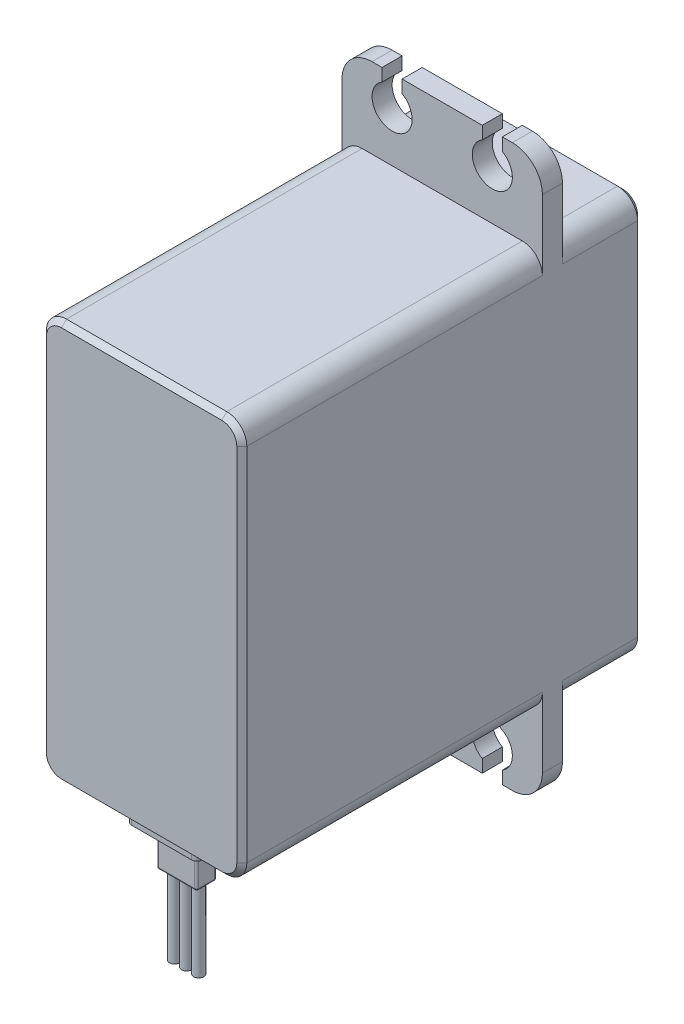
from build123d import *

# Parameters (mm, degrees)
SKETCH_1_W             = 20
SKETCH_1_H             = 56
EXTRUDE_1_DEPTH        = 40
SKETCH_2_OUTSIDE_W     = 36.334
SKETCH_2_OUTSIDE_H     = 72.334
SKETCH_2_OUTSIDE_W_2   = 20
SKETCH_2_OUTSIDE_H_2   = 40
CUT_EXTRUDE_1_DEPTH    = 30
CUT_EXTRUDE_START      = -40
SKETCH_2_2_OUTSIDE_W   = 36.334
SKETCH_2_2_OUTSIDE_H   = 72.334
SKETCH_2_2_OUTSIDE_W_2 = 20
SKETCH_2_2_OUTSIDE_H_2 = 40
CUT_EXTRUDE_2_DEPTH    = 8
CUT_EXTRUDE_3_DEPTH    = 43.237424164
SKETCH_4_W             = 7
SKETCH_4_H             = 5
EXTRUDE_2_DEPTH        = 2
SKETCH_5_W             = 4
SKETCH_5_H             = 2
EXTRUDE_3_DEPTH        = 4
SKETCH_6_R             = 0.5
EXTRUDE_4_DEPTH        = 8
SKETCH_7_R             = 6
EXTRUDE_5_DEPTH        = 2
SKETCH_8_R             = 5
CUT_EXTRUDE_4_DEPTH    = 0.8
SKETCH_9_R             = 2.5
CUT_EXTRUDE_5_DEPTH    = 4
SKETCH_10_R            = 2.5
EXTRUDE_6_DEPTH        = 10
CUT_EXTRUDE_6_DEPTH    = 60.02406289
FILLET_1_R             = 3
FILLET_2_R             = 2
FILLET_3_R             = 0.5
FILLET_4_R             = 0.2
CHAMFER_1_SIZE         = 0.5


with BuildPart() as part:
    # 草图1 → 凸台-拉伸1 (new body)
    with BuildSketch(Plane.XY):
        Rectangle(SKETCH_1_W, SKETCH_1_H)
    extrude(amount=EXTRUDE_1_DEPTH)

    # 草图2 outside → 切除-拉伸1 (cut)
    with BuildSketch(Plane.XY.offset(40)):
        Rectangle(SKETCH_2_OUTSIDE_W, SKETCH_2_OUTSIDE_H)
        Rectangle(SKETCH_2_OUTSIDE_W_2, SKETCH_2_OUTSIDE_H_2, mode=Mode.SUBTRACT)
    extrude(amount=-CUT_EXTRUDE_1_DEPTH, mode=Mode.SUBTRACT)

    # 草图2<2> outside → 切除-拉伸2 (cut)
    with BuildSketch(Plane.XY.offset(40).offset(CUT_EXTRUDE_START)):
        Rectangle(SKETCH_2_2_OUTSIDE_W, SKETCH_2_2_OUTSIDE_H)
        Rectangle(SKETCH_2_2_OUTSIDE_W_2, SKETCH_2_2_OUTSIDE_H_2, mode=Mode.SUBTRACT)
    extrude(amount=CUT_EXTRUDE_2_DEPTH, mode=Mode.SUBTRACT)

    # 草图3 → 切除-拉伸3 (cut, through all)
    with BuildSketch(Plane.XY.offset(10)):
        with BuildLine():
            Line((4, 26.732050808), (4, 28))
            Line((4, 28), (6, 28))
            Line((6, 28), (6, 26.732050808))
            ThreePointArc((6, 26.732050808), (5, 23), (4, 26.732050808))
        make_face()
        with BuildLine():
            Line((-6, 26.732050808), (-6, 28))
            Line((-6, 28), (-4, 28))
            Line((-4, 28), (-4, 26.732050808))
            ThreePointArc((-4, 26.732050808), (-5, 23), (-6, 26.732050808))
        make_face()
        with BuildLine():
            Line((-4, -28), (-4, -26.732050808))
            ThreePointArc((-4, -26.732050808), (-5, -23), (-6, -26.732050808))
            Line((-6, -26.732050808), (-6, -28))
            Line((-6, -28), (-4, -28))
        make_face()
        with BuildLine():
            Line((6, -28), (6, -26.732050808))
            ThreePointArc((6, -26.732050808), (5, -23), (4, -26.732050808))
            Line((4, -26.732050808), (4, -28))
            Line((4, -28), (6, -28))
        make_face()
    extrude(amount=-CUT_EXTRUDE_3_DEPTH, mode=Mode.SUBTRACT)

    # 草图4 → 凸台-拉伸2 (add)
    with BuildSketch(Plane.XZ.offset(20)):
        with Locations((0, 35.5)):
            Rectangle(SKETCH_4_W, SKETCH_4_H)
    extrude(amount=EXTRUDE_2_DEPTH)

    # 草图5 → 凸台-拉伸3 (add)
    with BuildSketch(Plane.XZ.offset(22)):
        with Locations((0, 35.5)):
            Rectangle(SKETCH_5_W, SKETCH_5_H)
    extrude(amount=EXTRUDE_3_DEPTH)

    # 草图6 → 凸台-拉伸4 (add)
    with BuildSketch(Plane.XZ.offset(26)):
        with Locations(Location((1.2, 35.5, 0), (0, 0, 90))):
            Circle(SKETCH_6_R)
        with Locations(Location((0, 35.5, 0), (0, 0, 90))):
            Circle(SKETCH_6_R)
        with Locations(Location((-1.2, 35.5, 0), (0, 0, 90))):
            Circle(SKETCH_6_R)
    extrude(amount=EXTRUDE_4_DEPTH)

    # 草图7 → 凸台-拉伸5 (add)
    with BuildSketch(Plane(origin=(0, 0, 0), x_dir=(-1, 0, 0), z_dir=(0, 0, -1))):
        with Locations((0, -12)):
            Circle(SKETCH_7_R)
    extrude(amount=EXTRUDE_5_DEPTH)

    # 草图8 → 切除-拉伸4 (cut)
    with BuildSketch(Plane(origin=(0, 0, -2), x_dir=(-1, 0, 0), z_dir=(0, 0, -1))):
        with Locations((0, -12)):
            Circle(SKETCH_8_R)
    extrude(amount=-CUT_EXTRUDE_4_DEPTH, mode=Mode.SUBTRACT)

    # 草图9 → 切除-拉伸5 (cut)
    with BuildSketch(Plane(origin=(0, 0, -1.2), x_dir=(-1, 0, 0), z_dir=(0, 0, -1))):
        with Locations((0, -12)):
            Circle(SKETCH_9_R)
    extrude(amount=-CUT_EXTRUDE_5_DEPTH, mode=Mode.SUBTRACT)


with BuildPart() as body_2:
    # 草图10 → 凸台-拉伸6 (new body)
    with BuildSketch(Plane(origin=(0, 0, 2.8), x_dir=(-1, 0, 0), z_dir=(0, 0, -1))):
        with Locations((0, -12)):
            Circle(SKETCH_10_R)
    extrude(amount=EXTRUDE_6_DEPTH)

    # 草图11 → 切除-拉伸6 (cut, through all)
    with BuildSketch(Plane(origin=(0, 0, -7.2), x_dir=(-1, 0, 0), z_dir=(0, 0, -1))):
        with BuildLine():
            Line((0, -10), (-0.27961852, -9.515686517))
            ThreePointArc((-0.27961852, -9.515686517), (0, -9.5), (0.27961852, -9.515686517))
            Line((0.27961852, -9.515686517), (0, -10))
        make_face()
        with BuildLine():
            Line((0.618033989, -10.097886967), (0.50176207, -9.550870599))
            ThreePointArc((0.50176207, -9.550870599), (0.772542486, -9.622358709), (1.033628101, -9.723684348))
            Line((1.033628101, -9.723684348), (0.618033989, -10.097886967))
        make_face()
        with BuildLine():
            Line((1.175570505, -10.381966011), (1.234026693, -9.82579253))
            ThreePointArc((1.234026693, -9.82579253), (1.469463131, -9.977457514), (1.686458962, -10.154503815))
            Line((1.686458962, -10.154503815), (1.175570505, -10.381966011))
        make_face()
        with BuildLine():
            Line((1.618033989, -10.824429495), (1.845496185, -10.313541038))
            ThreePointArc((1.845496185, -10.313541038), (2.022542486, -10.530536869), (2.17420747, -10.765973307))
            Line((2.17420747, -10.765973307), (1.618033989, -10.824429495))
        make_face()
        with BuildLine():
            Line((1.902113033, -11.381966011), (2.276315652, -10.966371899))
            ThreePointArc((2.276315652, -10.966371899), (2.377641291, -11.227457514), (2.449129401, -11.49823793))
            Line((2.449129401, -11.49823793), (1.902113033, -11.381966011))
        make_face()
        with BuildLine():
            Line((2, -12), (2.484313483, -11.72038148))
            ThreePointArc((2.484313483, -11.72038148), (2.5, -12), (2.484313483, -12.27961852))
            Line((2.484313483, -12.27961852), (2, -12))
        make_face()
        with BuildLine():
            Line((1.902113033, -12.618033989), (2.449129401, -12.50176207))
            ThreePointArc((2.449129401, -12.50176207), (2.377641291, -12.772542486), (2.276315652, -13.033628101))
            Line((2.276315652, -13.033628101), (1.902113033, -12.618033989))
        make_face()
        with BuildLine():
            Line((1.618033989, -13.175570505), (2.17420747, -13.234026693))
            ThreePointArc((2.17420747, -13.234026693), (2.022542486, -13.469463131), (1.845496185, -13.686458962))
            Line((1.845496185, -13.686458962), (1.618033989, -13.175570505))
        make_face()
        with BuildLine():
            Line((1.175570505, -13.618033989), (1.686458962, -13.845496185))
            ThreePointArc((1.686458962, -13.845496185), (1.469463131, -14.022542486), (1.234026693, -14.17420747))
            Line((1.234026693, -14.17420747), (1.175570505, -13.618033989))
        make_face()
        with BuildLine():
            Line((0.618033989, -13.902113033), (1.033628101, -14.276315652))
            ThreePointArc((1.033628101, -14.276315652), (0.772542486, -14.377641291), (0.50176207, -14.449129401))
            Line((0.50176207, -14.449129401), (0.618033989, -13.902113033))
        make_face()
        with BuildLine():
            Line((0, -14), (0.27961852, -14.484313483))
            ThreePointArc((0.27961852, -14.484313483), (0, -14.5), (-0.27961852, -14.484313483))
            Line((-0.27961852, -14.484313483), (0, -14))
        make_face()
        with BuildLine():
            Line((-0.618033989, -13.902113033), (-0.50176207, -14.449129401))
            ThreePointArc((-0.50176207, -14.449129401), (-0.772542486, -14.377641291), (-1.033628101, -14.276315652))
            Line((-1.033628101, -14.276315652), (-0.618033989, -13.902113033))
        make_face()
        with BuildLine():
            Line((-1.175570505, -13.618033989), (-1.234026693, -14.17420747))
            ThreePointArc((-1.234026693, -14.17420747), (-1.469463131, -14.022542486), (-1.686458962, -13.845496185))
            Line((-1.686458962, -13.845496185), (-1.175570505, -13.618033989))
        make_face()
        with BuildLine():
            Line((-1.618033989, -13.175570505), (-1.845496185, -13.686458962))
            ThreePointArc((-1.845496185, -13.686458962), (-2.022542486, -13.469463131), (-2.17420747, -13.234026693))
            Line((-2.17420747, -13.234026693), (-1.618033989, -13.175570505))
        make_face()
        with BuildLine():
            Line((-1.902113033, -12.618033989), (-2.276315652, -13.033628101))
            ThreePointArc((-2.276315652, -13.033628101), (-2.377641291, -12.772542486), (-2.449129401, -12.50176207))
            Line((-2.449129401, -12.50176207), (-1.902113033, -12.618033989))
        make_face()
        with BuildLine():
            Line((-2, -12), (-2.484313483, -12.27961852))
            ThreePointArc((-2.484313483, -12.27961852), (-2.5, -12), (-2.484313483, -11.72038148))
            Line((-2.484313483, -11.72038148), (-2, -12))
        make_face()
        with BuildLine():
            Line((-1.902113033, -11.381966011), (-2.449129401, -11.49823793))
            ThreePointArc((-2.449129401, -11.49823793), (-2.377641291, -11.227457514), (-2.276315652, -10.966371899))
            Line((-2.276315652, -10.966371899), (-1.902113033, -11.381966011))
        make_face()
        with BuildLine():
            Line((-1.618033989, -10.824429495), (-2.17420747, -10.765973307))
            ThreePointArc((-2.17420747, -10.765973307), (-2.022542486, -10.530536869), (-1.845496185, -10.313541038))
            Line((-1.845496185, -10.313541038), (-1.618033989, -10.824429495))
        make_face()
        with BuildLine():
            Line((-1.175570505, -10.381966011), (-1.686458962, -10.154503815))
            ThreePointArc((-1.686458962, -10.154503815), (-1.469463131, -9.977457514), (-1.234026693, -9.82579253))
            Line((-1.234026693, -9.82579253), (-1.175570505, -10.381966011))
        make_face()
        with BuildLine():
            Line((-0.618033989, -10.097886967), (-1.033628101, -9.723684348))
            ThreePointArc((-1.033628101, -9.723684348), (-0.772542486, -9.622358709), (-0.50176207, -9.550870599))
            Line((-0.50176207, -9.550870599), (-0.618033989, -10.097886967))
        make_face()
    extrude(amount=-CUT_EXTRUDE_6_DEPTH, mode=Mode.SUBTRACT)

    # 草图12 → 切除-旋转1 (revolve, cut)
    with BuildSketch(Plane(origin=(0, 0, 0), x_dir=(0, 0, -1), z_dir=(1, 0, 0))):
        Polygon((7.2, -10), (7.2, -8), (6.045299462, -8), align=None)
    cut_revolve_1 = revolve(axis=Axis((0, -12, -7.2), (0, 0, 1)), mode=Mode.SUBTRACT)

    # 镜向1: 切除-旋转1 across plane
    add(cut_revolve_1.mirror(Plane.XY.offset(-2.2)), mode=Mode.SUBTRACT)


with BuildPart() as hole_wizard_m2_1_tool:
    # 草图13 → M2 螺纹孔1 (revolve)
    with BuildSketch(Plane(origin=(0, -12, -7.2), x_dir=(0, 1, 0), z_dir=(1, 0, 0))):
        Polygon((0, 0), (0, 10.480688495), (0.8, 10), (0.8, 0), align=None)
    revolve(axis=Axis((0, -12, -13.55), (0, 0, 1)))


with BuildPart() as part_1:
    add(part.part)

    # M2 螺纹孔1: cut by hole_wizard_m2_1_tool
    add(hole_wizard_m2_1_tool.part, mode=Mode.SUBTRACT)

    # 圆角1
    fillet_1_edges = [part_1.edges().sort_by_distance(p)[0] for p in [
        (10, -28, 9),
        (-10, -28, 9),
        (-10, 28, 9),
        (10, 28, 9),
    ]]
    fillet(fillet_1_edges, radius=FILLET_1_R)

    # 圆角2
    fillet_2_edges = [part_1.edges().sort_by_distance(p)[0] for p in [
        (10, -20, 25),
        (-10, -20, 25),
        (-10, 20, 25),
        (10, 20, 25),
        (-10, 20, 4),
        (-10, -20, 4),
        (10, -20, 4),
        (10, 20, 4),
    ]]
    fillet(fillet_2_edges, radius=FILLET_2_R)

    # 圆角3
    fillet_3_edges = [part_1.edges().sort_by_distance(p)[0] for p in [
        (3.5, -21, 33),
        (3.5, -21, 38),
        (-3.5, -21, 38),
        (-3.5, -21, 33),
    ]]
    fillet(fillet_3_edges, radius=FILLET_3_R)

    # 圆角4
    fillet_4_edges = [part_1.edges().sort_by_distance(p)[0] for p in [
        (2, -24, 34.5),
        (2, -24, 36.5),
        (-2, -24, 36.5),
        (-2, -24, 34.5),
        (2, -26, 35.5),
        (0, -26, 36.5),
        (-2, -26, 35.5),
        (0, -26, 34.5),
    ]]
    fillet(fillet_4_edges, radius=FILLET_4_R)

    # 倒角1
    chamfer_1_edges = [part_1.edges().sort_by_distance(p)[0] for p in [
        (6, -12, -2),
        (-10, 0, 40),
        (-10, 0, 0),
        (0, 20, 0),
        (10, 0, 0),
        (0, -20, 0),
        (9.414213562, 19.414213562, 0),
        (9.414213562, -19.414213562, 0),
        (-9.414213562, -19.414213562, 0),
        (-9.414213562, 19.414213562, 0),
        (10, 0, 40),
        (0, -20, 40),
        (0, 20, 40),
        (9.414213562, 19.414213562, 40),
        (9.414213562, -19.414213562, 40),
        (-9.414213562, 19.414213562, 40),
        (-9.414213562, -19.414213562, 40),
    ]]
    chamfer(chamfer_1_edges, length=CHAMFER_1_SIZE)


with BuildPart() as body_2_1:
    add(body_2.part)

    # M2 螺纹孔1: cut by hole_wizard_m2_1_tool
    add(hole_wizard_m2_1_tool.part, mode=Mode.SUBTRACT)


solid = Compound([part_1.part, body_2_1.part])
